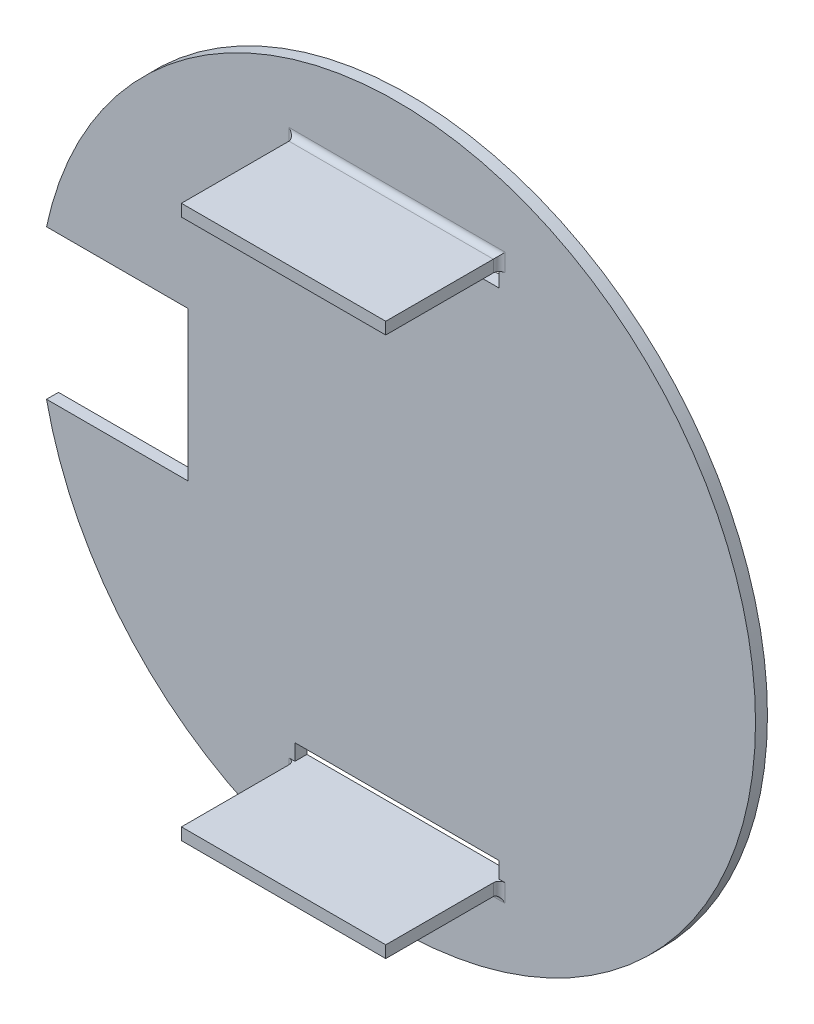
from build123d import *

# Parameters (mm, degrees)
CROQUIS1_W              = 34.2
CROQUIS1_H              = 2.7
SALIENTE_EXTRUIR1_DEPTH = 2
CROQUIS2_W              = 34.2
CROQUIS2_H              = 2
SALIENTE_EXTRUIR2_DEPTH = 19
REDONDEO1_R             = 1


with BuildPart() as part:
    # Croquis1 → Saliente-Extruir1 (new body)
    with BuildSketch(Plane.XY):
        with BuildLine():
            Line((-58.683472972, -12.5), (-35, -12.5))
            Line((-35, -12.5), (-35, 12.5))
            Line((-35, 12.5), (-58.683472972, 12.5))
            ThreePointArc((-58.683472972, 12.5), (60, 0), (-58.683472972, -12.5))
        make_face()
        with Locations((0, 42.85)):
            Rectangle(CROQUIS1_W, CROQUIS1_H, mode=Mode.SUBTRACT)
        with Locations((0, -42.85)):
            Rectangle(CROQUIS1_W, CROQUIS1_H, mode=Mode.SUBTRACT)
    extrude(amount=SALIENTE_EXTRUIR1_DEPTH)

    # Croquis2 → Saliente-Extruir2 (add)
    with BuildSketch(Plane.XY.offset(2)):
        with Locations((0, 45.2)):
            Rectangle(CROQUIS2_W, CROQUIS2_H)
        with Locations((0, -45.2)):
            Rectangle(CROQUIS2_W, CROQUIS2_H)
    extrude(amount=SALIENTE_EXTRUIR2_DEPTH)

    # Redondeo1
    redondeo1_edges = [part.edges().sort_by_distance(p)[0] for p in [
        (-17.1, 45.2, 2),
        (17.1, 45.2, 2),
        (0, 46.2, 2),
        (-17.1, -45.2, 2),
        (0, -46.2, 2),
        (17.1, -45.2, 2),
    ]]
    fillet(redondeo1_edges, radius=REDONDEO1_R)


solid = part.part
